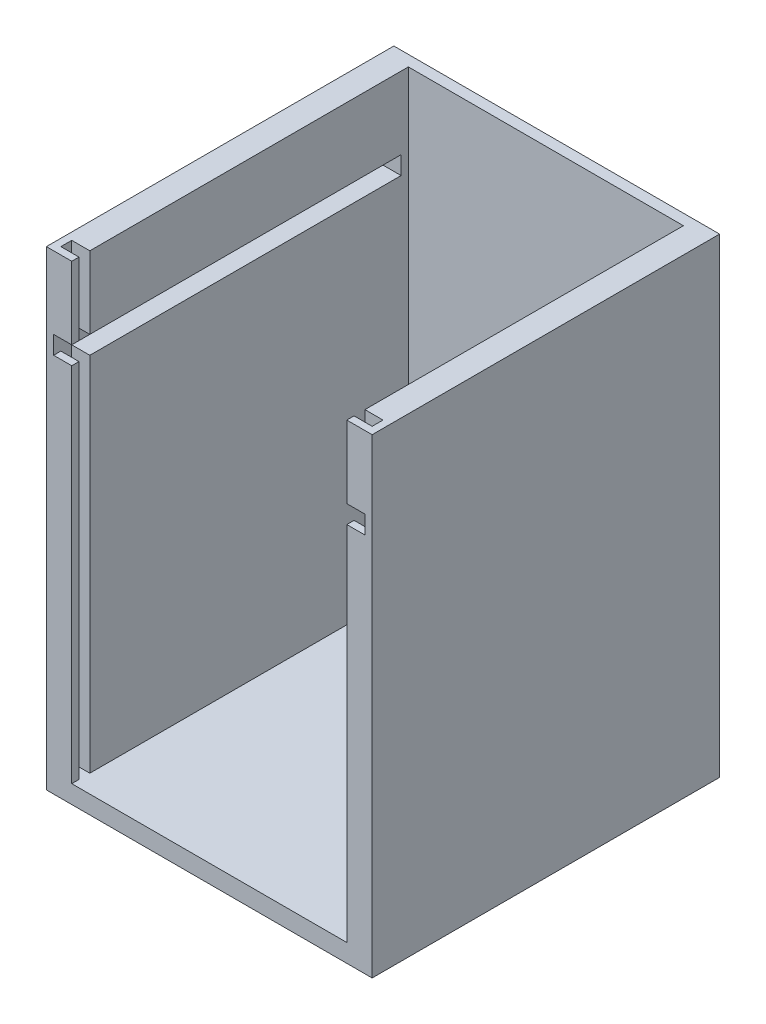
from build123d import *

# Parameters (mm, degrees)
SKETCH_1_W           = 96
SKETCH_1_H           = 130
EXTRUDE_1_DEPTH      = 96
SKETCH_3_W           = 76
SKETCH_3_H           = 93
CUT_EXTRUDE_1_DEPTH  = 130
SKETCH_8_W           = 86
SKETCH_8_H           = 125
CUT_EXTRUDE_5_DEPTH  = 3
SKETCH_10_W          = 91
SKETCH_10_H          = 5
CUT_EXTRUDE_7_DEPTH  = 86
SKETCH_15_W          = 96
SKETCH_15_H          = 130
CUT_EXTRUDE_10_DEPTH = 3
SKETCH_16_W          = 96
SKETCH_16_H          = 130
CUT_EXTRUDE_11_DEPTH = 3


with BuildPart() as part:
    # 草圖1 → 填料-伸長1 (new body)
    with BuildSketch(Plane.XY):
        with Locations((48, -65)):
            Rectangle(SKETCH_1_W, SKETCH_1_H)
    extrude(amount=EXTRUDE_1_DEPTH)

    # 草圖3 → 除料-伸長1 (cut)
    with BuildSketch(Plane(origin=(0, -125, 0), x_dir=(-1, 0, 0), z_dir=(0, -1, 0))):
        with Locations((-48, -49.5)):
            Rectangle(SKETCH_3_W, SKETCH_3_H)
    extrude(amount=-CUT_EXTRUDE_1_DEPTH, mode=Mode.SUBTRACT)

    # 草圖8 → 除料-伸長5 (cut)
    with BuildSketch(Plane.XY.offset(94)):
        with Locations((48, -62.5)):
            Rectangle(SKETCH_8_W, SKETCH_8_H)
    extrude(amount=-CUT_EXTRUDE_5_DEPTH, mode=Mode.SUBTRACT)

    # 草圖10 → 除料-伸長7 (cut)
    with BuildSketch(Plane.ZY.offset(-5)):
        with Locations((50.5, -22.5)):
            Rectangle(SKETCH_10_W, SKETCH_10_H)
    extrude(amount=-CUT_EXTRUDE_7_DEPTH, mode=Mode.SUBTRACT)

    # 草圖15 → 除料-伸長10 (cut)
    with BuildSketch(Plane.ZY):
        with Locations((48, -65)):
            Rectangle(SKETCH_15_W, SKETCH_15_H)
    extrude(amount=-CUT_EXTRUDE_10_DEPTH, mode=Mode.SUBTRACT)

    # 草圖16 → 除料-伸長11 (cut)
    with BuildSketch(Plane(origin=(96, 0, 0), x_dir=(0, 0, -1), z_dir=(1, 0, 0))):
        with Locations((-48, -65)):
            Rectangle(SKETCH_16_W, SKETCH_16_H)
    extrude(amount=-CUT_EXTRUDE_11_DEPTH, mode=Mode.SUBTRACT)


solid = part.part
